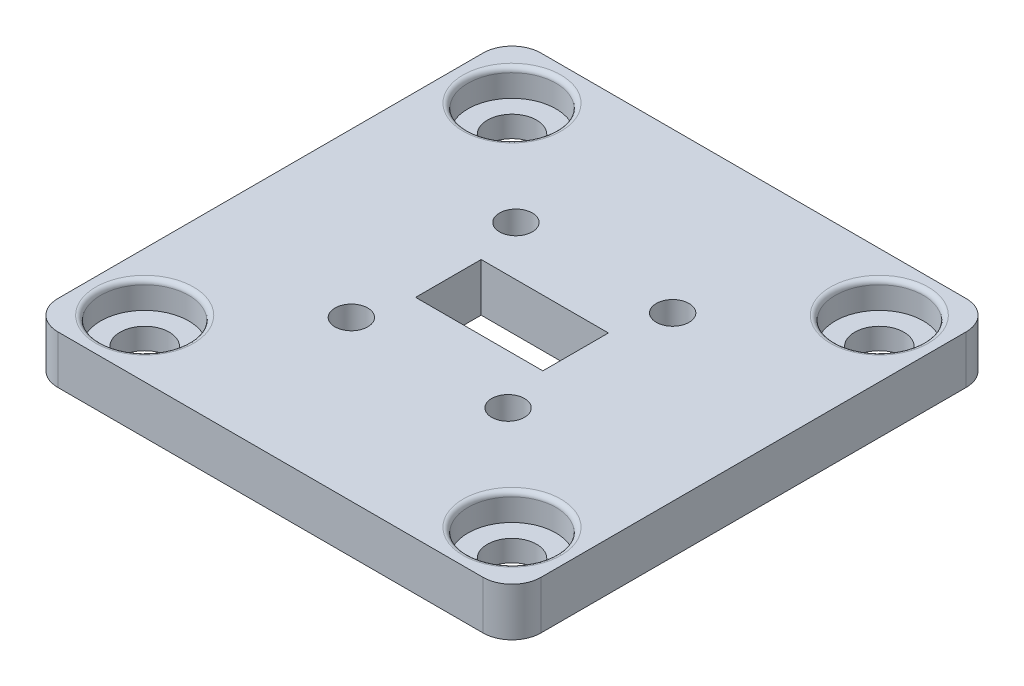
from build123d import *

# Parameters (mm, degrees)
SKETCH1_W           = 50.1
SKETCH1_H           = 50.1
SKETCH1_R           = 1.7
SKETCH1_R_2         = 2.5527
SKETCH1_W_2         = 13.2
SKETCH1_H_2         = 6.8
BOSS_EXTRUDE1_DEPTH = 5
FILLET1_R           = 3
CUT_EXTRUDE1_DEPTH  = 2.6
SKETCH5_R           = 4.5675
CUT_EXTRUDE4_DEPTH  = 2.8
FILLET2_R           = 0.5


with BuildPart() as part:
    # Sketch1 → Boss-Extrude1 (new body)
    with BuildSketch(Plane(origin=(0, 0, 0), x_dir=(1, 0, 0), z_dir=(0, 1, 0))):
        Rectangle(SKETCH1_W, SKETCH1_H)
        with Locations(Location((8.128, 8.5344, 0), (0, 0, 270))):
            Circle(SKETCH1_R, mode=Mode.SUBTRACT)
        with Locations(Location((-8.128, 8.5344, 0), (0, 0, 270))):
            Circle(SKETCH1_R, mode=Mode.SUBTRACT)
        with Locations(Location((19.05, 19.05, 0), (0, 0, 270))):
            Circle(SKETCH1_R_2, mode=Mode.SUBTRACT)
        with Locations(Location((-19.05, 19.05, 0), (0, 0, 270))):
            Circle(SKETCH1_R_2, mode=Mode.SUBTRACT)
        with Locations(Location((19.05, -19.05, 0), (0, 0, 270))):
            Circle(SKETCH1_R_2, mode=Mode.SUBTRACT)
        with Locations(Location((-19.05, -19.05, 0), (0, 0, 270))):
            Circle(SKETCH1_R_2, mode=Mode.SUBTRACT)
        with Locations(Location((8.128, -8.5344, 0), (0, 0, 270))):
            Circle(SKETCH1_R, mode=Mode.SUBTRACT)
        with Locations(Location((-8.128, -8.5344, 0), (0, 0, 270))):
            Circle(SKETCH1_R, mode=Mode.SUBTRACT)
        Rectangle(SKETCH1_W_2, SKETCH1_H_2, mode=Mode.SUBTRACT)
    extrude(amount=BOSS_EXTRUDE1_DEPTH)

    # Fillet1
    fillet1_edges = [part.edges().sort_by_distance(p)[0] for p in [
        (-25.05, 2.5, 25.05),
        (-25.05, 2.5, -25.05),
        (25.05, 2.5, -25.05),
        (25.05, 2.5, 25.05),
    ]]
    fillet(fillet1_edges, radius=FILLET1_R)

    # Sketch2 → Cut-Extrude1 (cut)
    with BuildSketch(Plane.XZ):
        Polygon((-8.128, 11.709826481), (-10.878, 10.12211324), (-10.878, 6.94668676), (-8.128, 5.358973519), (-5.378, 6.94668676), (-5.378, 10.12211324), align=None)
        Polygon((8.128, 11.709826481), (5.378, 10.12211324), (5.378, 6.94668676), (8.128, 5.358973519), (10.878, 6.94668676), (10.878, 10.12211324), align=None)
        Polygon((-8.128, -5.358973519), (-10.878, -6.94668676), (-10.878, -10.12211324), (-8.128, -11.709826481), (-5.378, -10.12211324), (-5.378, -6.94668676), align=None)
        Polygon((8.128, -5.358973519), (5.378, -6.94668676), (5.378, -10.12211324), (8.128, -11.709826481), (10.878, -10.12211324), (10.878, -6.94668676), align=None)
    extrude(amount=-CUT_EXTRUDE1_DEPTH, mode=Mode.SUBTRACT)

    # Sketch5 → Cut-Extrude4 (cut)
    with BuildSketch(Plane(origin=(0, 5, 0), x_dir=(1, 0, 0), z_dir=(0, 1, 0))):
        with Locations(Location((-19.05, 19.05, 0), (0, 0, 270))):
            Circle(SKETCH5_R)
        with Locations(Location((19.05, 19.05, 0), (0, 0, 270))):
            Circle(SKETCH5_R)
        with Locations(Location((19.05, -19.05, 0), (0, 0, 270))):
            Circle(SKETCH5_R)
        with Locations(Location((-19.05, -19.05, 0), (0, 0, 270))):
            Circle(SKETCH5_R)
    extrude(amount=-CUT_EXTRUDE4_DEPTH, mode=Mode.SUBTRACT)

    # Fillet2
    fillet2_edges = [part.edges().sort_by_distance(p)[0] for p in [
        (-19.05, 5, 14.4825),
        (19.05, 5, 14.4825),
        (19.05, 5, -23.6175),
        (-19.05, 5, -23.6175),
    ]]
    fillet(fillet2_edges, radius=FILLET2_R)


solid = part.part
